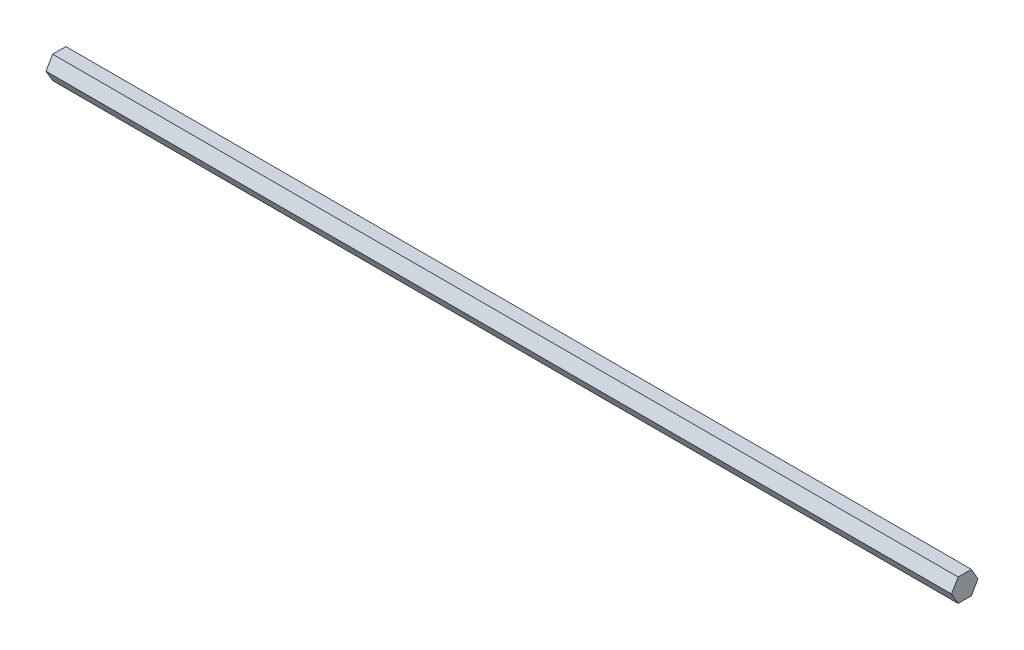
from build123d import *

# Parameters (mm, degrees)
BOSS_EXTRUDE1_DEPTH = 250.825


with BuildPart() as part:
    # Sketch1 → Boss-Extrude1 (new, symmetric)
    with BuildSketch(Plane(origin=(0, 0, 0), x_dir=(0, 0, -1), z_dir=(1, 0, 0))):
        Polygon((-3.666174209, 6.35), (-7.332348419, 0), (-3.666174209, -6.35), (3.666174209, -6.35), (7.332348419, 0), (3.666174209, 6.35), align=None)
    extrude(amount=BOSS_EXTRUDE1_DEPTH, both=True)


solid = part.part
